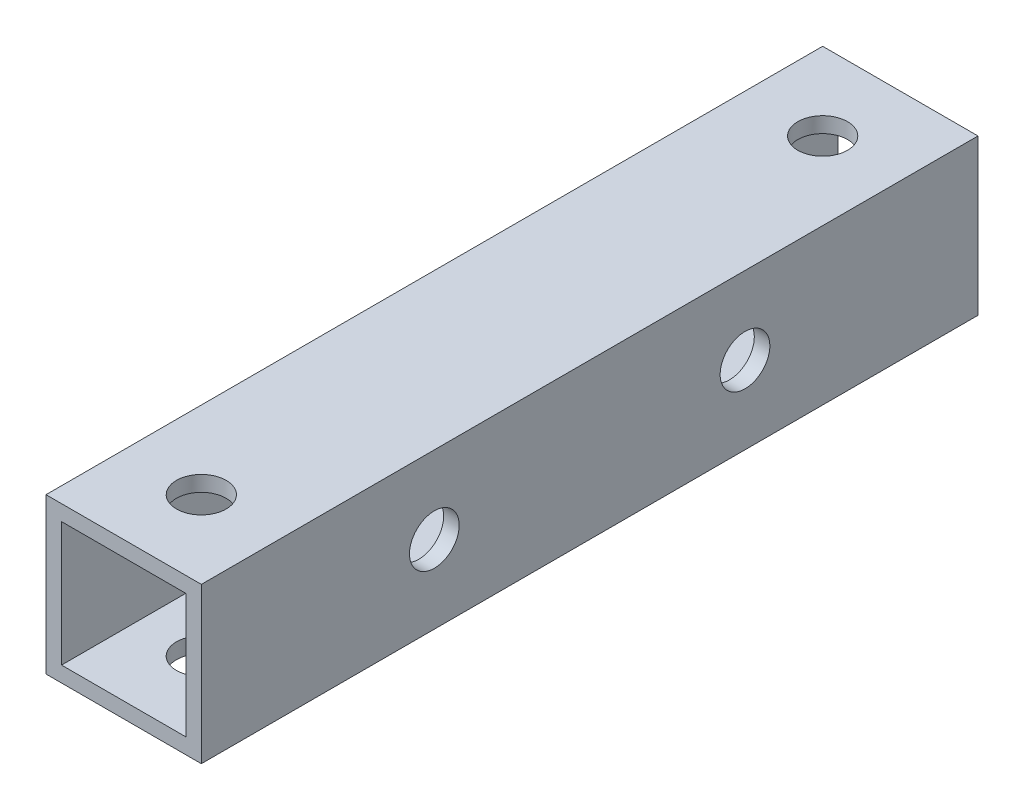
from build123d import *

# Parameters (mm, degrees)
SKETCH_1_W          = 10
SKETCH_1_H          = 10
SKETCH_1_W_2        = 8
SKETCH_1_H_2        = 8
EXTRUDE_1_DEPTH     = 50
SKETCH_2_R          = 1.6
CUT_EXTRUDE_1_DEPTH = 52.23475383
SKETCH_3_R          = 1.6
CUT_EXTRUDE_2_DEPTH = 52.23475383


with BuildPart() as part:
    # ｽｹｯﾁ1 → ﾎﾞｽ - 押し出し1 (new body)
    with BuildSketch(Plane.XY):
        Rectangle(SKETCH_1_W, SKETCH_1_H)
        Rectangle(SKETCH_1_W_2, SKETCH_1_H_2, mode=Mode.SUBTRACT)
    extrude(amount=EXTRUDE_1_DEPTH)

    # ｽｹｯﾁ2 → ｶｯﾄ - 押し出し1 (cut, through all)
    with BuildSketch(Plane(origin=(0, 5, 0), x_dir=(1, 0, 0), z_dir=(0, 1, 0))):
        with Locations(Location((0, -45, 0), (0, 0, 270))):
            Circle(SKETCH_2_R)
        with Locations(Location((0, -5, 0), (0, 0, 270))):
            Circle(SKETCH_2_R)
    extrude(amount=-CUT_EXTRUDE_1_DEPTH, mode=Mode.SUBTRACT)

    # ｽｹｯﾁ3 → ｶｯﾄ - 押し出し2 (cut, through all)
    with BuildSketch(Plane.ZY.offset(5)):
        with Locations(Location((15, 0, 0), (0, 0, 270))):
            Circle(SKETCH_3_R)
        with Locations(Location((35, 0, 0), (0, 0, 270))):
            Circle(SKETCH_3_R)
    extrude(amount=-CUT_EXTRUDE_2_DEPTH, mode=Mode.SUBTRACT)


solid = part.part
